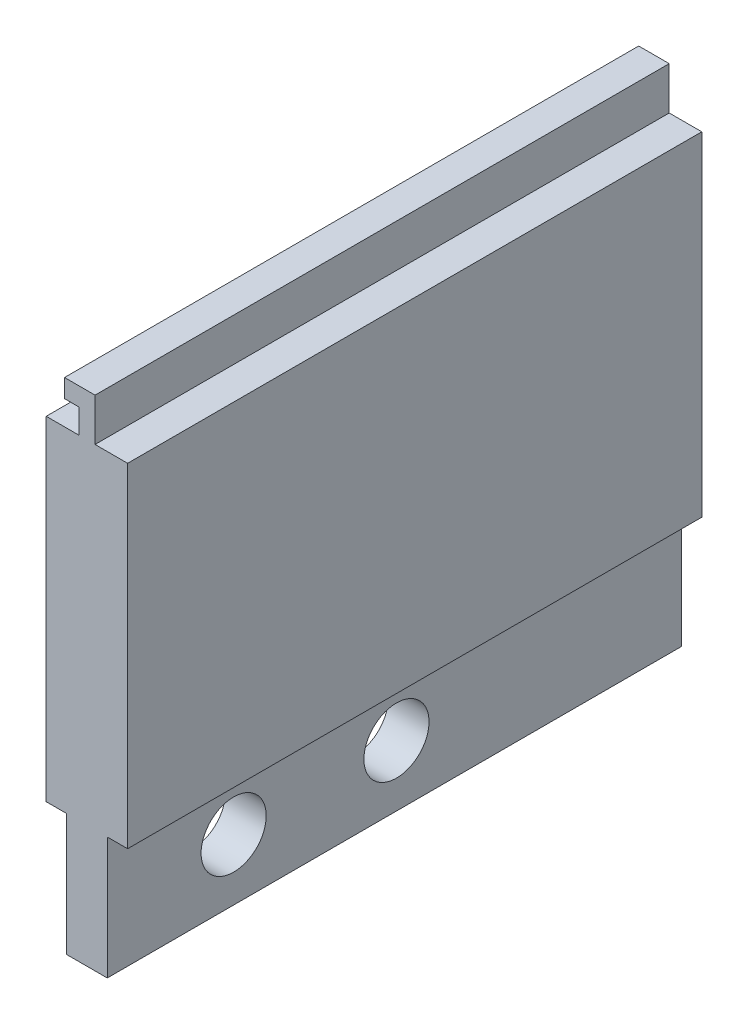
from build123d import *

# Parameters (mm, degrees)
SKETCH_1_W          = 0.8
SKETCH_1_H          = 2.1
SKETCH_1_W_2        = 2
SKETCH_1_H_2        = 6
SKETCH_1_W_3        = 0.7
SKETCH_1_H_3        = 0.9
EXTRUDE_1_DEPTH     = 20
SKETCH_3_R          = 1.6
CUT_EXTRUDE_1_DEPTH = 37.762616882
EXTRUDE_2_DEPTH     = 8.208511786


with BuildPart() as part:
    # 草图1 → 凸台-拉伸1 (new body)
    with BuildSketch(Plane.XY):
        with Locations((2, -7.25)):
            Rectangle(SKETCH_1_W, SKETCH_1_H)
        Polygon((4, -8.3), (2.4, -8.3), (1.6, -8.3), (0, -8.3), (0, -24.7), (1, -24.7), (3, -24.7), (4, -24.7), align=None)
        with Locations((2, -27.7)):
            Rectangle(SKETCH_1_W_2, SKETCH_1_H_2)
        with Locations((1.25, -6.65)):
            Rectangle(SKETCH_1_W_3, SKETCH_1_H_3)
    extrude(amount=-EXTRUDE_1_DEPTH)

    # 草图3 → 切除-拉伸1 (cut, through all)
    with BuildSketch(Plane(origin=(3, 0, 0), x_dir=(0, 0, -1), z_dir=(1, 0, 0))):
        with Locations(Location((6.208511786, -27.7, 0), (0, 0, 90))):
            Circle(SKETCH_3_R)
        with Locations(Location((14.208511786, -27.7, 0), (0, 0, 90))):
            Circle(SKETCH_3_R)
    extrude(amount=-CUT_EXTRUDE_1_DEPTH, mode=Mode.SUBTRACT)

    # 草图4 → 凸台-拉伸2 (add)
    with BuildSketch(Plane(origin=(0, 0, -20), x_dir=(-1, 0, 0), z_dir=(0, 0, -1))):
        Polygon((-0.9, -6.2), (-2.4, -6.2), (-2.4, -8.3), (-4, -8.3), (-4, -24.7), (-3, -24.7), (-3, -30.7), (-1, -30.7), (-1, -24.7), (0, -24.7), (0, -8.3), (-1.6, -8.3), (-1.6, -7.1), (-0.9, -7.1), align=None)
    extrude(amount=EXTRUDE_2_DEPTH)


solid = part.part
